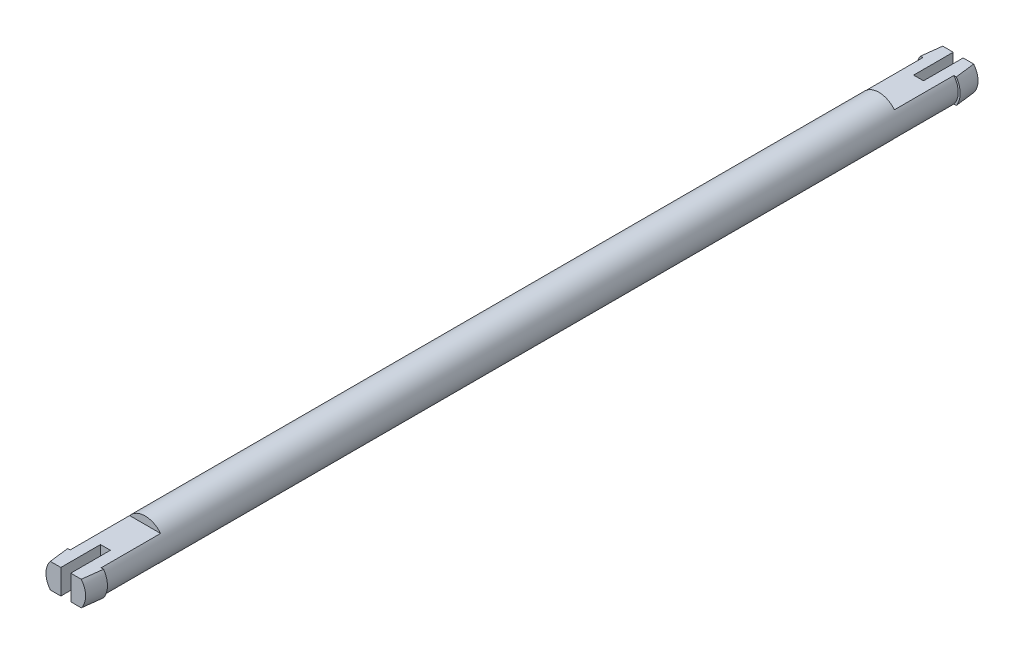
from build123d import *

# Parameters (mm, degrees)
SKETCH_1_R          = 2
EXTRUDE_1_DEPTH     = 90
SKETCH_3_W          = 4.2
SKETCH_3_H          = 1
CUT_EXTRUDE_1_DEPTH = 8
CUT_EXTRUDE_2_REACH = 92.086
SKETCH_4_W          = 1
SKETCH_4_H          = 4
SKETCH_6_W          = 4.2
SKETCH_6_H          = 1
CUT_EXTRUDE_3_DEPTH = 8
SKETCH_7_W          = 1
SKETCH_7_H          = 4
CUT_EXTRUDE_4_DEPTH = 91.085528805


with BuildPart() as part:
    # 草图1 → 凸台-拉伸1 (new body)
    with BuildSketch(Plane.XY):
        Circle(SKETCH_1_R)
    extrude(amount=-EXTRUDE_1_DEPTH)

    # 草图2 → 旋转1 (revolve)
    with BuildSketch(Plane(origin=(0, 0, 0), x_dir=(1, 0, 0), z_dir=(0, 1, 0))):
        Polygon((0, 0), (0, 2), (2.2, 2), (2, 0), align=None)
    revolve(axis=Axis((0, 0, 0), (0, 0, -1)))

    # 草图3 → 切除-拉伸1 (cut)
    with BuildSketch(Plane.XY):
        with Locations((0, 1.75)):
            Rectangle(SKETCH_3_W, SKETCH_3_H)
        with Locations((0, -1.75)):
            Rectangle(SKETCH_3_W, SKETCH_3_H)
    extrude(amount=-CUT_EXTRUDE_1_DEPTH, mode=Mode.SUBTRACT)

    # 草图4 → 切除-拉伸2 (cut, up to next)
    with BuildSketch(Plane.XZ.offset(1.25), mode=Mode.PRIVATE) as cut_extrude_2_sk1:
        with Locations((0, -2)):
            Rectangle(SKETCH_4_W, SKETCH_4_H)
    cut_extrude_2_tool1 = extrude(cut_extrude_2_sk1.sketch, amount=-CUT_EXTRUDE_2_REACH, mode=Mode.PRIVATE) & part.part
    add(cut_extrude_2_tool1.solids().sort_by_distance((0, -1.25, -2))[0], mode=Mode.SUBTRACT)

    # 草图5 → 旋转2 (revolve)
    with BuildSketch(Plane(origin=(0, 0, 0), x_dir=(1, 0, 0), z_dir=(0, 1, 0))):
        Polygon((0, 90), (0, 88), (2.2, 88), (2, 90), align=None)
    revolve(axis=Axis((0, 0, -58.137689197), (0, 0, -1)))

    # 草图6 → 切除-拉伸3 (cut)
    with BuildSketch(Plane(origin=(0, 0, -90), x_dir=(-1, 0, 0), z_dir=(0, 0, -1))):
        with Locations((0, 1.75)):
            Rectangle(SKETCH_6_W, SKETCH_6_H)
        with Locations((0, -1.75)):
            Rectangle(SKETCH_6_W, SKETCH_6_H)
    extrude(amount=-CUT_EXTRUDE_3_DEPTH, mode=Mode.SUBTRACT)

    # 草图7 → 切除-拉伸4 (cut, through all)
    with BuildSketch(Plane(origin=(0, 1.25, 0), x_dir=(1, 0, 0), z_dir=(0, 1, 0))):
        with Locations((0, 88)):
            Rectangle(SKETCH_7_W, SKETCH_7_H)
    extrude(amount=-CUT_EXTRUDE_4_DEPTH, mode=Mode.SUBTRACT)


solid = part.part
